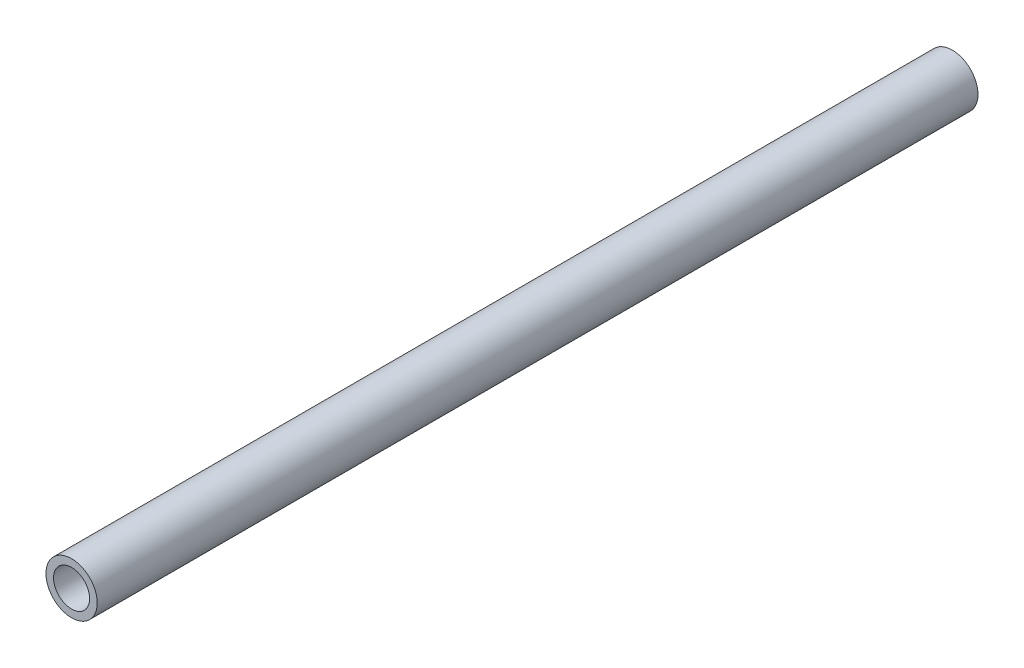
from build123d import *

# Parameters (mm, degrees)
SKETCH1_R           = 13.5
SKETCH1_R_2         = 9.5
BOSS_EXTRUDE1_DEPTH = 464


with BuildPart() as part:
    # Sketch1 → Boss-Extrude1 (new body)
    with BuildSketch(Plane.XY):
        with Locations((351.5, -19)):
            Circle(SKETCH1_R)
        with Locations((351.5, -19)):
            Circle(SKETCH1_R_2, mode=Mode.SUBTRACT)
    extrude(amount=BOSS_EXTRUDE1_DEPTH)


solid = part.part
